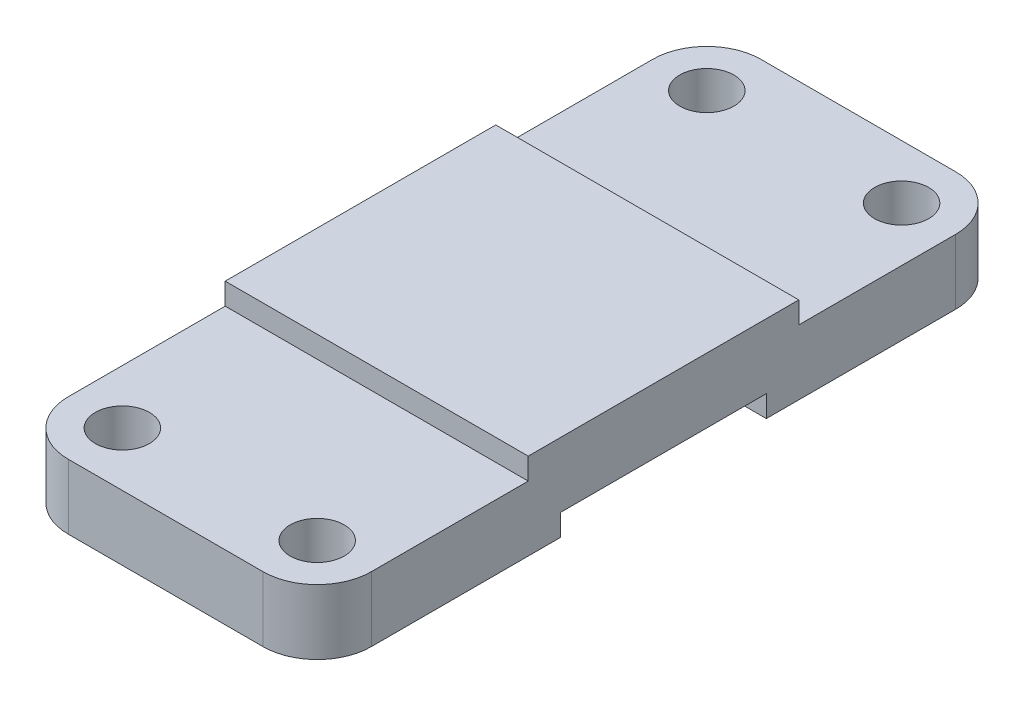
from build123d import *

# Parameters (mm, degrees)
BOSS_EXTRUDE1_DEPTH = 56
FILLET1_R           = 10
SKETCH2_R           = 5
CUT_EXTRUDE1_DEPTH  = 141.228385144


with BuildPart() as part:
    # Sketch1 → Boss-Extrude1 (new body)
    with BuildSketch(Plane(origin=(0, 0, 0), x_dir=(0, 0, -1), z_dir=(1, 0, 0))):
        Polygon((89, 12), (128, 12), (128, 0), (83, 0), (83, 4), (45, 4), (45, 0), (0, 0), (0, 12), (39, 12), (39, 16), (89, 16), align=None)
    extrude(amount=-BOSS_EXTRUDE1_DEPTH)

    # Fillet1
    fillet1_edges = [part.edges().sort_by_distance(p)[0] for p in [
        (0, 6, -128),
        (0, 6, 0),
        (-56, 6, -128),
        (-56, 6, 0),
    ]]
    fillet(fillet1_edges, radius=FILLET1_R)

    # Sketch2 → Cut-Extrude1 (cut, through all)
    with BuildSketch(Plane(origin=(0, 12, 0), x_dir=(1, 0, 0), z_dir=(0, 1, 0))):
        with Locations(Location((-46, 118, 0), (0, 0, 270))):
            Circle(SKETCH2_R)
        with Locations(Location((-10, 118, 0), (0, 0, 270))):
            Circle(SKETCH2_R)
        with Locations(Location((-10, 10, 0), (0, 0, 270))):
            Circle(SKETCH2_R)
        with Locations(Location((-46, 10, 0), (0, 0, 270))):
            Circle(SKETCH2_R)
    extrude(amount=-CUT_EXTRUDE1_DEPTH, mode=Mode.SUBTRACT)


solid = part.part
